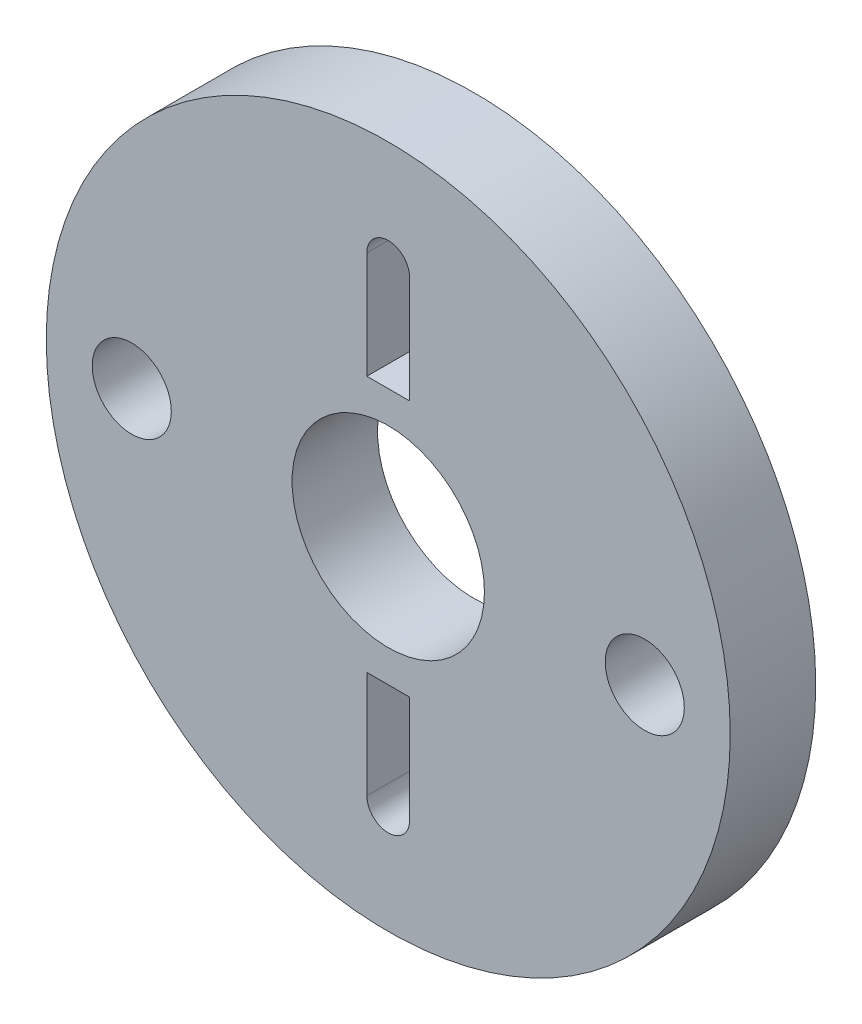
from build123d import *

# Parameters (mm, degrees)
SKETCH_1_R      = 16
SKETCH_1_R_2    = 4.5
SKETCH_1_R_3    = 1.85
EXTRUDE_1_DEPTH = 2


with BuildPart() as part:
    # 草图1 → 凸台-拉伸1 (new, symmetric)
    with BuildSketch(Plane.XY):
        Circle(SKETCH_1_R)
        Circle(SKETCH_1_R_2, mode=Mode.SUBTRACT)
        with Locations((-12, 0)):
            Circle(SKETCH_1_R_3, mode=Mode.SUBTRACT)
        with Locations((12, 0)):
            Circle(SKETCH_1_R_3, mode=Mode.SUBTRACT)
        with BuildLine():
            Line((-1, 6), (-1, 11))
            ThreePointArc((-1, 11), (0, 12), (1, 11))
            Line((1, 11), (1, 6))
            Line((1, 6), (-1, 6))
        make_face(mode=Mode.SUBTRACT)
        with BuildLine():
            Line((1, -6), (1, -11))
            ThreePointArc((1, -11), (0, -12), (-1, -11))
            Line((-1, -11), (-1, -6))
            Line((-1, -6), (1, -6))
        make_face(mode=Mode.SUBTRACT)
    extrude(amount=EXTRUDE_1_DEPTH, both=True)


solid = part.part
